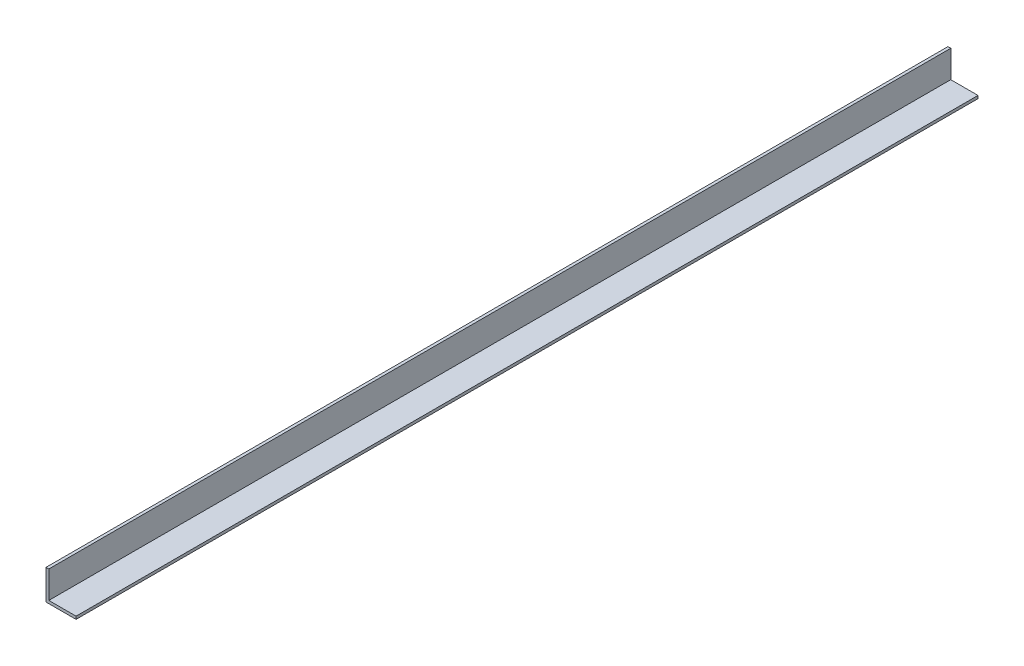
from build123d import *

# Parameters (mm, degrees)
SALIENTE_EXTRUIR1_DEPTH = 6100


with BuildPart() as part:
    # Croquis1 → Saliente-Extruir1 (new body)
    with BuildSketch(Plane.XY):
        Polygon((0, 203.3), (0, 0), (203.3, 0), (203.3, 19.05), (19.05, 19.05), (19.05, 203.3), align=None)
    extrude(amount=-SALIENTE_EXTRUIR1_DEPTH)


solid = part.part
